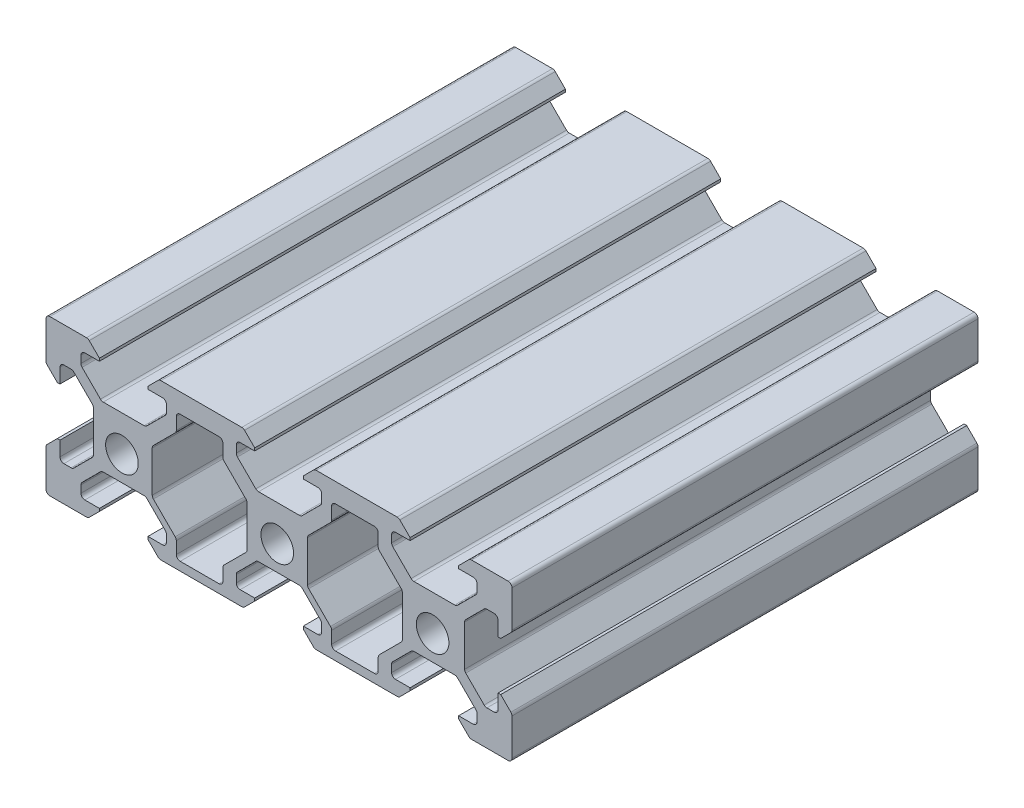
from build123d import *

# Parameters (mm, degrees)
SKETCH1_R           = 2.1
BOSS_EXTRUDE1_DEPTH = 60


with BuildPart() as part:
    # Sketch1 → Boss-Extrude1 (new body)
    with BuildSketch(Plane.XY):
        with BuildLine():
            Line((-22.409183164, -3.200852904), (-17.14471707, -3.200852904))
            ThreePointArc((-17.14471707, -3.200852904), (-16.953375354, -3.238913137), (-16.79116368, -3.347299513))
            Line((-16.79116368, -3.347299513), (-14.423396727, -5.715066466))
            ThreePointArc((-14.423396727, -5.715066466), (-14.315010351, -5.87727814), (-14.276950117, -6.068619857))
            Line((-14.276950117, -6.068619857), (-14.276950117, -7.000852904))
            ThreePointArc((-14.276950117, -7.000852904), (-14.423396727, -7.354406294), (-14.776950117, -7.500852904))
            Line((-14.776950117, -7.500852904), (-16.651950117, -7.500852904))
            Line((-16.651950117, -7.500852904), (-16.651950117, -7.845852904))
            Line((-16.651950117, -7.845852904), (-15.343396727, -9.154406294))
            ThreePointArc((-15.343396727, -9.154406294), (-15.181185052, -9.26279267), (-14.989843336, -9.300852904))
            Line((-14.989843336, -9.300852904), (-4.564056898, -9.300852904))
            ThreePointArc((-4.564056898, -9.300852904), (-4.372715182, -9.26279267), (-4.210503508, -9.154406294))
            Line((-4.210503508, -9.154406294), (-2.901950117, -7.845852904))
            Line((-2.901950117, -7.845852904), (-2.901950117, -7.500852904))
            Line((-2.901950117, -7.500852904), (-4.776950117, -7.500852904))
            ThreePointArc((-4.776950117, -7.500852904), (-5.130503508, -7.354406294), (-5.276950117, -7.000852904))
            Line((-5.276950117, -7.000852904), (-5.276950117, -6.068619857))
            ThreePointArc((-5.276950117, -6.068619857), (-5.238889883, -5.87727814), (-5.130503508, -5.715066466))
            Line((-5.130503508, -5.715066466), (-2.762736555, -3.347299513))
            ThreePointArc((-2.762736555, -3.347299513), (-2.60052488, -3.238913137), (-2.409183164, -3.200852904))
            Line((-2.409183164, -3.200852904), (2.85528293, -3.200852904))
            ThreePointArc((2.85528293, -3.200852904), (3.046624646, -3.238913137), (3.20883632, -3.347299513))
            Line((3.20883632, -3.347299513), (5.576603273, -5.715066466))
            ThreePointArc((5.576603273, -5.715066466), (5.684989649, -5.87727814), (5.723049883, -6.068619857))
            Line((5.723049883, -6.068619857), (5.723049883, -7.000852904))
            ThreePointArc((5.723049883, -7.000852904), (5.576603273, -7.354406294), (5.223049883, -7.500852904))
            Line((5.223049883, -7.500852904), (3.348049883, -7.500852904))
            Line((3.348049883, -7.500852904), (3.348049883, -7.845852904))
            Line((3.348049883, -7.845852904), (4.656603273, -9.154406294))
            ThreePointArc((4.656603273, -9.154406294), (4.818814948, -9.26279267), (5.010156664, -9.300852904))
            Line((5.010156664, -9.300852904), (15.435943102, -9.300852904))
            ThreePointArc((15.435943102, -9.300852904), (15.627284818, -9.26279267), (15.789496492, -9.154406294))
            Line((15.789496492, -9.154406294), (17.098049883, -7.845852904))
            Line((17.098049883, -7.845852904), (17.098049883, -7.500852904))
            Line((17.098049883, -7.500852904), (15.223049883, -7.500852904))
            ThreePointArc((15.223049883, -7.500852904), (14.869496492, -7.354406294), (14.723049883, -7.000852904))
            Line((14.723049883, -7.000852904), (14.723049883, -6.068619857))
            ThreePointArc((14.723049883, -6.068619857), (14.761110117, -5.87727814), (14.869496492, -5.715066466))
            Line((14.869496492, -5.715066466), (17.237263445, -3.347299513))
            ThreePointArc((17.237263445, -3.347299513), (17.39947512, -3.238913137), (17.590816836, -3.200852904))
            Line((17.590816836, -3.200852904), (22.85528293, -3.200852904))
            ThreePointArc((22.85528293, -3.200852904), (23.046624646, -3.238913137), (23.20883632, -3.347299513))
            Line((23.20883632, -3.347299513), (25.576603273, -5.715066466))
            ThreePointArc((25.576603273, -5.715066466), (25.684989649, -5.87727814), (25.723049883, -6.068619857))
            Line((25.723049883, -6.068619857), (25.723049883, -7.000852904))
            ThreePointArc((25.723049883, -7.000852904), (25.576603273, -7.354406294), (25.223049883, -7.500852904))
            Line((25.223049883, -7.500852904), (23.348049883, -7.500852904))
            Line((23.348049883, -7.500852904), (23.348049883, -7.845852904))
            Line((23.348049883, -7.845852904), (24.656603273, -9.154406294))
            ThreePointArc((24.656603273, -9.154406294), (24.818814948, -9.26279267), (25.010156664, -9.300852904))
            Line((25.010156664, -9.300852904), (29.723049883, -9.300852904))
            ThreePointArc((29.723049883, -9.300852904), (30.076603273, -9.154406294), (30.223049883, -8.800852904))
            Line((30.223049883, -8.800852904), (30.223049883, -4.087959685))
            ThreePointArc((30.223049883, -4.087959685), (30.184989649, -3.896617969), (30.076603273, -3.734406294))
            Line((30.076603273, -3.734406294), (28.768049883, -2.425852904))
            Line((28.768049883, -2.425852904), (28.423049883, -2.425852904))
            Line((28.423049883, -2.425852904), (28.423049883, -4.300852904))
            ThreePointArc((28.423049883, -4.300852904), (28.276603273, -4.654406294), (27.923049883, -4.800852904))
            Line((27.923049883, -4.800852904), (26.990816836, -4.800852904))
            ThreePointArc((26.990816836, -4.800852904), (26.79947512, -4.76279267), (26.637263445, -4.654406294))
            Line((26.637263445, -4.654406294), (24.269496492, -2.286639341))
            ThreePointArc((24.269496492, -2.286639341), (24.161110117, -2.124427667), (24.123049883, -1.933085951))
            Line((24.123049883, -1.933085951), (24.123049883, 3.331380143))
            ThreePointArc((24.123049883, 3.331380143), (24.161110117, 3.52272186), (24.269496492, 3.684933534))
            Line((24.269496492, 3.684933534), (26.637263445, 6.052700487))
            ThreePointArc((26.637263445, 6.052700487), (26.79947512, 6.161086863), (26.990816836, 6.199147096))
            Line((26.990816836, 6.199147096), (27.923049883, 6.199147096))
            ThreePointArc((27.923049883, 6.199147096), (28.276603273, 6.052700487), (28.423049883, 5.699147096))
            Line((28.423049883, 5.699147096), (28.423049883, 3.824147096))
            Line((28.423049883, 3.824147096), (28.768049883, 3.824147096))
            Line((28.768049883, 3.824147096), (30.076603273, 5.132700487))
            ThreePointArc((30.076603273, 5.132700487), (30.184989649, 5.294912161), (30.223049883, 5.486253878))
            Line((30.223049883, 5.486253878), (30.223049883, 10.199147096))
            ThreePointArc((30.223049883, 10.199147096), (30.076603273, 10.552700487), (29.723049883, 10.699147096))
            Line((29.723049883, 10.699147096), (25.010156664, 10.699147096))
            ThreePointArc((25.010156664, 10.699147096), (24.818814948, 10.661086863), (24.656603273, 10.552700487))
            Line((24.656603273, 10.552700487), (23.348049883, 9.244147096))
            Line((23.348049883, 9.244147096), (23.348049883, 8.899147096))
            Line((23.348049883, 8.899147096), (25.223049883, 8.899147096))
            ThreePointArc((25.223049883, 8.899147096), (25.576603273, 8.752700487), (25.723049883, 8.399147096))
            Line((25.723049883, 8.399147096), (25.723049883, 7.466914049))
            ThreePointArc((25.723049883, 7.466914049), (25.684989649, 7.275572333), (25.576603273, 7.113360659))
            Line((25.576603273, 7.113360659), (23.20883632, 4.745593706))
            ThreePointArc((23.20883632, 4.745593706), (23.046624646, 4.63720733), (22.85528293, 4.599147096))
            Line((22.85528293, 4.599147096), (17.590816836, 4.599147096))
            ThreePointArc((17.590816836, 4.599147096), (17.39947512, 4.63720733), (17.237263445, 4.745593706))
            Line((17.237263445, 4.745593706), (14.869496492, 7.113360659))
            ThreePointArc((14.869496492, 7.113360659), (14.761110117, 7.275572333), (14.723049883, 7.466914049))
            Line((14.723049883, 7.466914049), (14.723049883, 8.399147096))
            ThreePointArc((14.723049883, 8.399147096), (14.869496492, 8.752700487), (15.223049883, 8.899147096))
            Line((15.223049883, 8.899147096), (17.098049883, 8.899147096))
            Line((17.098049883, 8.899147096), (17.098049883, 9.244147096))
            Line((17.098049883, 9.244147096), (15.789496492, 10.552700487))
            ThreePointArc((15.789496492, 10.552700487), (15.627284818, 10.661086863), (15.435943102, 10.699147096))
            Line((15.435943102, 10.699147096), (5.010156664, 10.699147096))
            ThreePointArc((5.010156664, 10.699147096), (4.818814948, 10.661086863), (4.656603273, 10.552700487))
            Line((4.656603273, 10.552700487), (3.348049883, 9.244147096))
            Line((3.348049883, 9.244147096), (3.348049883, 8.899147096))
            Line((3.348049883, 8.899147096), (5.223049883, 8.899147096))
            ThreePointArc((5.223049883, 8.899147096), (5.576603273, 8.752700487), (5.723049883, 8.399147096))
            Line((5.723049883, 8.399147096), (5.723049883, 7.466914049))
            ThreePointArc((5.723049883, 7.466914049), (5.684989649, 7.275572333), (5.576603273, 7.113360659))
            Line((5.576603273, 7.113360659), (3.20883632, 4.745593706))
            ThreePointArc((3.20883632, 4.745593706), (3.046624646, 4.63720733), (2.85528293, 4.599147096))
            Line((2.85528293, 4.599147096), (-2.409183164, 4.599147096))
            ThreePointArc((-2.409183164, 4.599147096), (-2.60052488, 4.63720733), (-2.762736555, 4.745593706))
            Line((-2.762736555, 4.745593706), (-5.130503508, 7.113360659))
            ThreePointArc((-5.130503508, 7.113360659), (-5.238889883, 7.275572333), (-5.276950117, 7.466914049))
            Line((-5.276950117, 7.466914049), (-5.276950117, 8.399147096))
            ThreePointArc((-5.276950117, 8.399147096), (-5.130503508, 8.752700487), (-4.776950117, 8.899147096))
            Line((-4.776950117, 8.899147096), (-2.901950117, 8.899147096))
            Line((-2.901950117, 8.899147096), (-2.901950117, 9.244147096))
            Line((-2.901950117, 9.244147096), (-4.210503508, 10.552700487))
            ThreePointArc((-4.210503508, 10.552700487), (-4.372715182, 10.661086863), (-4.564056898, 10.699147096))
            Line((-4.564056898, 10.699147096), (-14.989843336, 10.699147096))
            ThreePointArc((-14.989843336, 10.699147096), (-15.181185052, 10.661086863), (-15.343396727, 10.552700487))
            Line((-15.343396727, 10.552700487), (-16.651950117, 9.244147096))
            Line((-16.651950117, 9.244147096), (-16.651950117, 8.899147096))
            Line((-16.651950117, 8.899147096), (-14.776950117, 8.899147096))
            ThreePointArc((-14.776950117, 8.899147096), (-14.423396727, 8.752700487), (-14.276950117, 8.399147096))
            Line((-14.276950117, 8.399147096), (-14.276950117, 7.466914049))
            ThreePointArc((-14.276950117, 7.466914049), (-14.315010351, 7.275572333), (-14.423396727, 7.113360659))
            Line((-14.423396727, 7.113360659), (-16.79116368, 4.745593706))
            ThreePointArc((-16.79116368, 4.745593706), (-16.953375354, 4.63720733), (-17.14471707, 4.599147096))
            Line((-17.14471707, 4.599147096), (-22.409183164, 4.599147096))
            ThreePointArc((-22.409183164, 4.599147096), (-22.60052488, 4.63720733), (-22.762736555, 4.745593706))
            Line((-22.762736555, 4.745593706), (-25.130503508, 7.113360659))
            ThreePointArc((-25.130503508, 7.113360659), (-25.238889883, 7.275572333), (-25.276950117, 7.466914049))
            Line((-25.276950117, 7.466914049), (-25.276950117, 8.399147096))
            ThreePointArc((-25.276950117, 8.399147096), (-25.130503508, 8.752700487), (-24.776950117, 8.899147096))
            Line((-24.776950117, 8.899147096), (-22.901950117, 8.899147096))
            Line((-22.901950117, 8.899147096), (-22.901950117, 9.244147096))
            Line((-22.901950117, 9.244147096), (-24.210503508, 10.552700487))
            ThreePointArc((-24.210503508, 10.552700487), (-24.372715182, 10.661086863), (-24.564056898, 10.699147096))
            Line((-24.564056898, 10.699147096), (-29.276950117, 10.699147096))
            ThreePointArc((-29.276950117, 10.699147096), (-29.630503508, 10.552700487), (-29.776950117, 10.199147096))
            Line((-29.776950117, 10.199147096), (-29.776950117, 5.486253878))
            ThreePointArc((-29.776950117, 5.486253878), (-29.738889883, 5.294912161), (-29.630503508, 5.132700487))
            Line((-29.630503508, 5.132700487), (-28.321950117, 3.824147096))
            Line((-28.321950117, 3.824147096), (-27.976950117, 3.824147096))
            Line((-27.976950117, 3.824147096), (-27.976950117, 5.699147096))
            ThreePointArc((-27.976950117, 5.699147096), (-27.830503508, 6.052700487), (-27.476950117, 6.199147096))
            Line((-27.476950117, 6.199147096), (-26.54471707, 6.199147096))
            ThreePointArc((-26.54471707, 6.199147096), (-26.353375354, 6.161086863), (-26.19116368, 6.052700487))
            Line((-26.19116368, 6.052700487), (-23.823396727, 3.684933534))
            ThreePointArc((-23.823396727, 3.684933534), (-23.715010351, 3.52272186), (-23.676950117, 3.331380143))
            Line((-23.676950117, 3.331380143), (-23.676950117, -1.933085951))
            ThreePointArc((-23.676950117, -1.933085951), (-23.715010351, -2.124427667), (-23.823396727, -2.286639341))
            Line((-23.823396727, -2.286639341), (-26.19116368, -4.654406294))
            ThreePointArc((-26.19116368, -4.654406294), (-26.353375354, -4.76279267), (-26.54471707, -4.800852904))
            Line((-26.54471707, -4.800852904), (-27.476950117, -4.800852904))
            ThreePointArc((-27.476950117, -4.800852904), (-27.830503508, -4.654406294), (-27.976950117, -4.300852904))
            Line((-27.976950117, -4.300852904), (-27.976950117, -2.425852904))
            Line((-27.976950117, -2.425852904), (-28.321950117, -2.425852904))
            Line((-28.321950117, -2.425852904), (-29.630503508, -3.734406294))
            ThreePointArc((-29.630503508, -3.734406294), (-29.738889883, -3.896617969), (-29.776950117, -4.087959685))
            Line((-29.776950117, -4.087959685), (-29.776950117, -8.800852904))
            ThreePointArc((-29.776950117, -8.800852904), (-29.630503508, -9.154406294), (-29.276950117, -9.300852904))
            Line((-29.276950117, -9.300852904), (-24.564056898, -9.300852904))
            ThreePointArc((-24.564056898, -9.300852904), (-24.372715182, -9.26279267), (-24.210503508, -9.154406294))
            Line((-24.210503508, -9.154406294), (-22.901950117, -7.845852904))
            Line((-22.901950117, -7.845852904), (-22.901950117, -7.500852904))
            Line((-22.901950117, -7.500852904), (-24.776950117, -7.500852904))
            ThreePointArc((-24.776950117, -7.500852904), (-25.130503508, -7.354406294), (-25.276950117, -7.000852904))
            Line((-25.276950117, -7.000852904), (-25.276950117, -6.068619857))
            ThreePointArc((-25.276950117, -6.068619857), (-25.238889883, -5.87727814), (-25.130503508, -5.715066466))
            Line((-25.130503508, -5.715066466), (-22.762736555, -3.347299513))
            ThreePointArc((-22.762736555, -3.347299513), (-22.60052488, -3.238913137), (-22.409183164, -3.200852904))
        make_face()
        with Locations((-20, 0)):
            Circle(SKETCH1_R, mode=Mode.SUBTRACT)
        Circle(SKETCH1_R, mode=Mode.SUBTRACT)
        with Locations((20, 0)):
            Circle(SKETCH1_R, mode=Mode.SUBTRACT)
        with BuildLine():
            Line((-13, 7.7), (-13, 6.146446609))
            ThreePointArc((-13, 6.146446609), (-13.038060234, 5.955104893), (-13.146446609, 5.792893219))
            Line((-13.146446609, 5.792893219), (-15.953553391, 2.985786438))
            ThreePointArc((-15.953553391, 2.985786438), (-16.061939766, 2.823574763), (-16.1, 2.632233047))
            Line((-16.1, 2.632233047), (-16.1, -2.632233047))
            ThreePointArc((-16.1, -2.632233047), (-16.061939766, -2.823574763), (-15.953553391, -2.985786438))
            Line((-15.953553391, -2.985786438), (-13.146446609, -5.792893219))
            ThreePointArc((-13.146446609, -5.792893219), (-13.038060234, -5.955104893), (-13, -6.146446609))
            Line((-13, -6.146446609), (-13, -7.7))
            ThreePointArc((-13, -7.7), (-12.853553391, -8.053553391), (-12.5, -8.2))
            Line((-12.5, -8.2), (-7.5, -8.2))
            ThreePointArc((-7.5, -8.2), (-7.146446609, -8.053553391), (-7, -7.7))
            Line((-7, -7.7), (-7, -6.146446609))
            ThreePointArc((-7, -6.146446609), (-6.961939766, -5.955104893), (-6.853553391, -5.792893219))
            Line((-6.853553391, -5.792893219), (-4.046446609, -2.985786438))
            ThreePointArc((-4.046446609, -2.985786438), (-3.938060234, -2.823574763), (-3.9, -2.632233047))
            Line((-3.9, -2.632233047), (-3.9, 2.632233047))
            ThreePointArc((-3.9, 2.632233047), (-3.938060234, 2.823574763), (-4.046446609, 2.985786438))
            Line((-4.046446609, 2.985786438), (-6.853553391, 5.792893219))
            ThreePointArc((-6.853553391, 5.792893219), (-6.961939766, 5.955104893), (-7, 6.146446609))
            Line((-7, 6.146446609), (-7, 7.7))
            ThreePointArc((-7, 7.7), (-7.146446609, 8.053553391), (-7.5, 8.2))
            Line((-7.5, 8.2), (-12.5, 8.2))
            ThreePointArc((-12.5, 8.2), (-12.853553391, 8.053553391), (-13, 7.7))
        make_face(mode=Mode.SUBTRACT)
        with BuildLine():
            Line((12.5, -8.2), (7.5, -8.2))
            ThreePointArc((7.5, -8.2), (7.146446609, -8.053553391), (7, -7.7))
            Line((7, -7.7), (7, -6.146446609))
            ThreePointArc((7, -6.146446609), (6.961939766, -5.955104893), (6.853553391, -5.792893219))
            Line((6.853553391, -5.792893219), (4.046446609, -2.985786438))
            ThreePointArc((4.046446609, -2.985786438), (3.938060234, -2.823574763), (3.9, -2.632233047))
            Line((3.9, -2.632233047), (3.9, 2.632233047))
            ThreePointArc((3.9, 2.632233047), (3.938060234, 2.823574763), (4.046446609, 2.985786438))
            Line((4.046446609, 2.985786438), (6.853553391, 5.792893219))
            ThreePointArc((6.853553391, 5.792893219), (6.961939766, 5.955104893), (7, 6.146446609))
            Line((7, 6.146446609), (7, 7.7))
            ThreePointArc((7, 7.7), (7.146446609, 8.053553391), (7.5, 8.2))
            Line((7.5, 8.2), (12.5, 8.2))
            ThreePointArc((12.5, 8.2), (12.853553391, 8.053553391), (13, 7.7))
            Line((13, 7.7), (13, 6.146446609))
            ThreePointArc((13, 6.146446609), (13.038060234, 5.955104893), (13.146446609, 5.792893219))
            Line((13.146446609, 5.792893219), (15.953553391, 2.985786438))
            ThreePointArc((15.953553391, 2.985786438), (16.061939766, 2.823574763), (16.1, 2.632233047))
            Line((16.1, 2.632233047), (16.1, -2.632233047))
            ThreePointArc((16.1, -2.632233047), (16.061939766, -2.823574763), (15.953553391, -2.985786438))
            Line((15.953553391, -2.985786438), (13.146446609, -5.792893219))
            ThreePointArc((13.146446609, -5.792893219), (13.038060234, -5.955104893), (13, -6.146446609))
            Line((13, -6.146446609), (13, -7.7))
            ThreePointArc((13, -7.7), (12.853553391, -8.053553391), (12.5, -8.2))
        make_face(mode=Mode.SUBTRACT)
    extrude(amount=BOSS_EXTRUDE1_DEPTH)


solid = part.part
